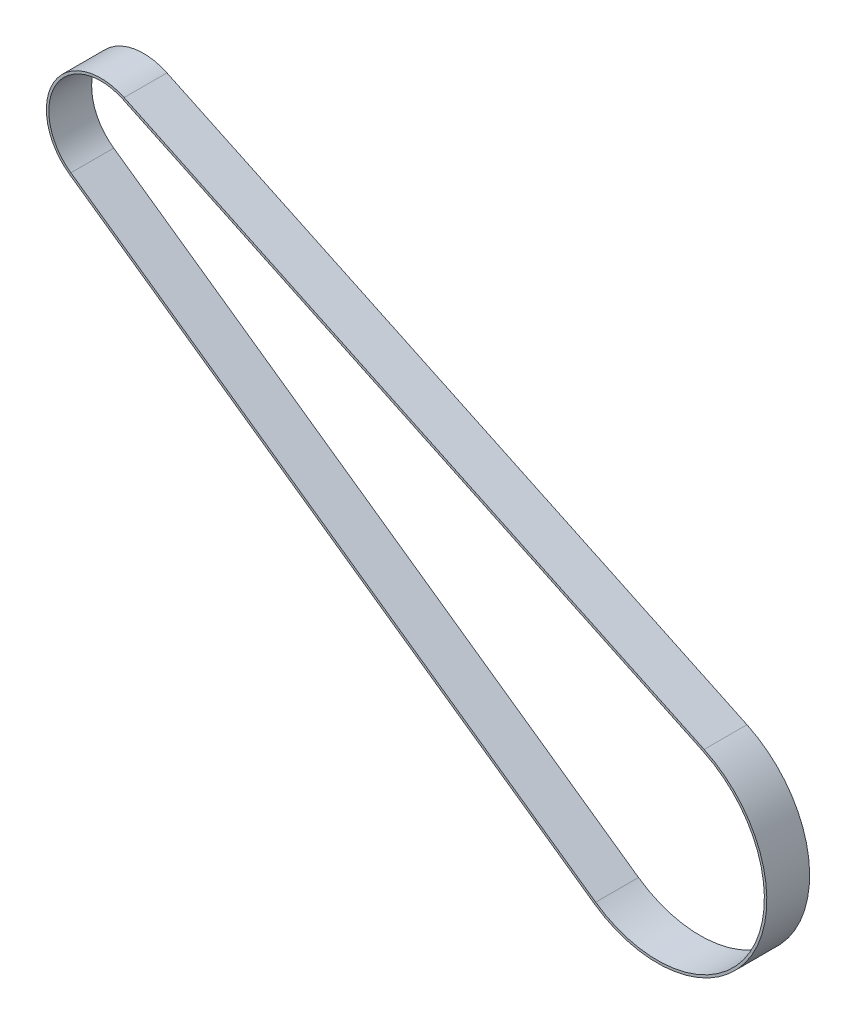
from build123d import *

# Parameters (mm, degrees)
BOSS_EXTRUDE1_DEPTH = 44.45


with BuildPart() as part:
    # Sketch1 → Boss-Extrude1 (new body)
    with BuildSketch(Plane.XY):
        with BuildLine():
            Line((626.190357385, 102.741389288), (24.174367638, 387.633707523))
            ThreePointArc((24.174367638, 387.633707523), (-48.829920419, 365.003191331), (-32.523664529, 290.331427211))
            Line((-32.523664529, 290.331427211), (512.157236509, -92.956455384))
            ThreePointArc((512.157236509, -92.956455384), (675.778491629, -57.226081441), (626.190357385, 102.741389288))
        make_face()
        with BuildLine():
            Line((625.103868952, 100.44549232), (23.087879205, 385.337810556))
            ThreePointArc((23.087879205, 385.337810556), (-46.635317254, 363.724396215), (-31.061926797, 292.408666438))
            Line((-31.061926797, 292.408666438), (513.618974241, -90.879216157))
            ThreePointArc((513.618974241, -90.879216157), (673.583888464, -55.947286325), (625.103868952, 100.44549232))
        make_face(mode=Mode.SUBTRACT)
    extrude(amount=BOSS_EXTRUDE1_DEPTH)


solid = part.part
